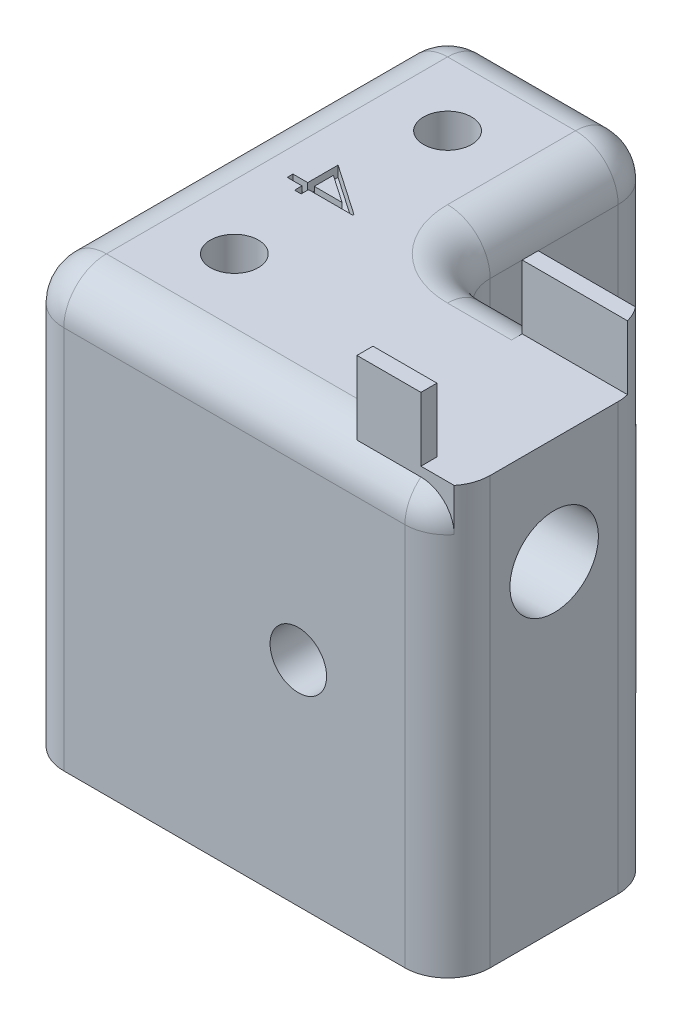
from build123d import *

# Parameters (mm, degrees)
SALIENTE_EXTRUIR1_DEPTH = 40
REDONDEO3_R             = 4
CROQUIS4_R              = 2.25
CORTAR_EXTRUIR3_DEPTH   = 70.282032303
CROQUIS5_R              = 4.15
CORTAR_EXTRUIR4_DEPTH   = 25
CORTAR_EXTRUIR6_DEPTH   = 1
CROQUIS9_R              = 2.65
CORTAR_EXTRUIR7_DEPTH   = 24
SALIENTE_EXTRUIR2_DEPTH = 5
SALIENTE_EXTRUIR3_START = 6
CROQUIS12_W             = 6
CROQUIS12_H             = 1.5
SALIENTE_EXTRUIR3_DEPTH = 6


with BuildPart() as part:
    # Croquis1 → Saliente-Extruir1 (new body)
    with BuildSketch(Plane(origin=(0, 0, 0), x_dir=(1, 0, 0), z_dir=(0, 1, 0))):
        Polygon((0, 0), (40, 0), (40, 20), (20, 20), (20, 40), (0, 40), align=None)
    extrude(amount=SALIENTE_EXTRUIR1_DEPTH)

    # Redondeo3
    redondeo3_edges = [part.edges().sort_by_distance(p)[0] for p in [
        (40, 40, -10),
        (0, 20, -40),
        (20, 20, -40),
        (20, 20, -20),
        (40, 20, -20),
        (40, 20, 0),
        (0, 20, 0),
        (30, 40, -20),
        (20, 40, -30),
        (10, 40, -40),
        (0, 40, -20),
        (20, 40, 0),
    ]]
    fillet(redondeo3_edges, radius=REDONDEO3_R)

    # Croquis4 → Cortar-Extruir3 (cut, through all)
    with BuildSketch(Plane(origin=(0, 40, 0), x_dir=(1, 0, 0), z_dir=(0, 1, 0))):
        with Locations(Location((10, 30, 0), (0, 0, 270))):
            Circle(CROQUIS4_R)
        with Locations(Location((10, 10, 0), (0, 0, 270))):
            Circle(CROQUIS4_R)
    extrude(amount=-CORTAR_EXTRUIR3_DEPTH, mode=Mode.SUBTRACT)

    # Croquis5 → Cortar-Extruir4 (cut)
    with BuildSketch(Plane(origin=(40, 0, 0), x_dir=(0, 0, -1), z_dir=(1, 0, 0))):
        with Locations((10, 30)):
            Circle(CROQUIS5_R)
    extrude(amount=-CORTAR_EXTRUIR4_DEPTH, mode=Mode.SUBTRACT)

    # Croquis8 → Cortar-Extruir6 (cut)
    with BuildSketch(Plane(origin=(0, 40, 0), x_dir=(1, 0, 0), z_dir=(0, 1, 0))):
        Polygon((12.421293342, 18.801682692), (12.421293342, 18.692307692), (8.267447188, 18.692307692), (8.267447188, 18), (7.652062573, 18), (7.652062573, 18.692307692), (6.267447188, 18.692307692), (6.267447188, 19.230769231), (7.652062573, 19.230769231), (7.652062573, 22.076923077), align=None)
        Polygon((8.267447188, 19.230769231), (10.873216419, 19.230769231), (8.267447188, 21.019230769), align=None, mode=Mode.SUBTRACT)
    extrude(amount=-CORTAR_EXTRUIR6_DEPTH, mode=Mode.SUBTRACT)

    # Croquis9 → Cortar-Extruir7 (cut)
    with BuildSketch(Plane.XY):
        with Locations((26, 20)):
            Circle(CROQUIS9_R)
    extrude(amount=-CORTAR_EXTRUIR7_DEPTH, mode=Mode.SUBTRACT)

    # Croquis11 → Saliente-Extruir2 (add)
    with BuildSketch(Plane(origin=(0, 40, 0), x_dir=(1, 0, 0), z_dir=(0, 1, 0))):
        with BuildLine():
            Line((30, 18.5), (39.122498999, 18.5))
            ThreePointArc((39.122498999, 18.5), (39.774254628, 17.324764885), (40, 16))
            Line((40, 16), (40, 4))
            ThreePointArc((40, 4), (39.774254628, 2.675235115), (39.122498999, 1.5))
            Line((39.122498999, 1.5), (30, 1.5))
            Line((30, 1.5), (30, 18.5))
        make_face()
    extrude(amount=-SALIENTE_EXTRUIR2_DEPTH)

    # Croquis12 → Saliente-Extruir3 (add)
    with BuildSketch(Plane(origin=(0, 40, 0), x_dir=(1, 0, 0), z_dir=(0, 1, 0)).offset(SALIENTE_EXTRUIR3_START)):
        with Locations((33, 2.25)):
            Rectangle(CROQUIS12_W, CROQUIS12_H)
        with BuildLine():
            Line((30, 18.5), (39.122498999, 18.5))
            ThreePointArc((39.122498999, 18.5), (39.57724661, 17.789778391), (39.872983346, 17))
            Line((39.872983346, 17), (30, 17))
            Line((30, 17), (30, 18.5))
        make_face()
    extrude(amount=-SALIENTE_EXTRUIR3_DEPTH)


solid = part.part
